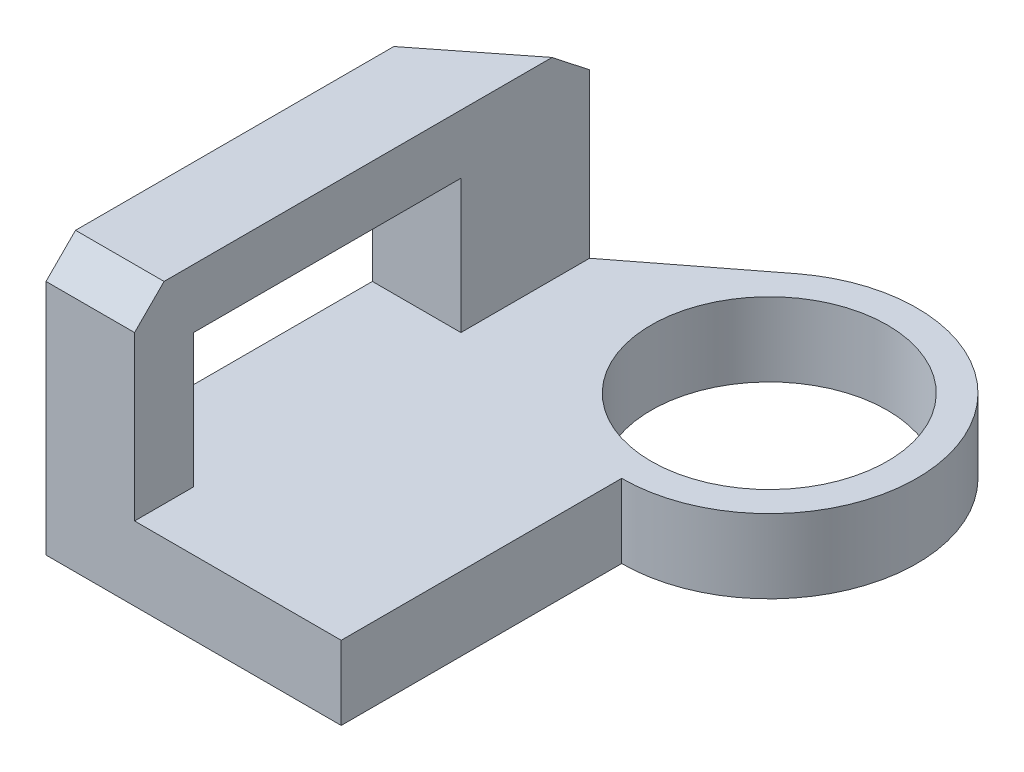
from build123d import *

# Parameters (mm, degrees)
BOSS_EXTRUDE1_DEPTH = 6.35
SKETCH6_W           = 7.62
SKETCH6_H           = 5.08
BOSS_EXTRUDE3_DEPTH = 16.58
SKETCH8_W           = 7.62
SKETCH8_H           = 5.08
BOSS_EXTRUDE4_DEPTH = 23
CHAMFER1_SIZE       = 2.54


with BuildPart() as part:
    # Sketch1 → Boss-Extrude1 (new body)
    with BuildSketch(Plane(origin=(0, 0, 0), x_dir=(1, 0, 0), z_dir=(0, 1, 0))):
        with BuildLine():
            Line((0, -36.83), (0, -12.7))
            ThreePointArc((0, -12.7), (12.020636157, 4.098085697), (-7.757731828, 10.055227341))
            Line((-7.757731828, 10.055227341), (-25.4, -3.556))
            Line((-25.4, -3.556), (-25.4, -17.326729584))
            Line((-25.4, -17.326729584), (-25.4, -17.78))
            Line((-25.4, -17.78), (-25.4, -36.83))
            Line((-25.4, -36.83), (0, -36.83))
        make_face()
        with BuildLine():
            ThreePointArc((10.16, 0), (0.750509795, -10.13224235), (-10.049121072, -1.496918727))
            ThreePointArc((-10.049121072, -1.496918727), (-10.15820415, 0.191019487), (-9.985739115, 1.873663342))
            ThreePointArc((-9.985739115, 1.873663342), (0.940874749, 10.116340974), (10.16, 0))
        make_face(mode=Mode.SUBTRACT)
    extrude(amount=BOSS_EXTRUDE1_DEPTH)

    # Sketch6 → Boss-Extrude3 (add)
    with BuildSketch(Plane(origin=(0, 6.35, 0), x_dir=(1, 0, 0), z_dir=(0, 1, 0))):
        Polygon((-17.78, -3.67), (-17.78, 2.322923919), (-25.4, -3.67), align=None)
        with Locations((-21.59, -6.21)):
            Rectangle(SKETCH6_W, SKETCH6_H)
        with Locations((-21.59, -34.29)):
            Rectangle(SKETCH6_W, SKETCH6_H)
    extrude(amount=BOSS_EXTRUDE3_DEPTH)

    # Sketch8 → Boss-Extrude4 (add)
    with BuildSketch(Plane.XY.offset(8.75)):
        with Locations((-21.59, 20.39)):
            Rectangle(SKETCH8_W, SKETCH8_H)
    extrude(amount=BOSS_EXTRUDE4_DEPTH)

    # Chamfer1
    chamfer1_edges = [part.edges().sort_by_distance(p)[0] for p in [
        (-21.59, 22.93, 0.673538041),
        (-21.59, 22.93, 36.83),
    ]]
    chamfer(chamfer1_edges, length=CHAMFER1_SIZE)


solid = part.part
